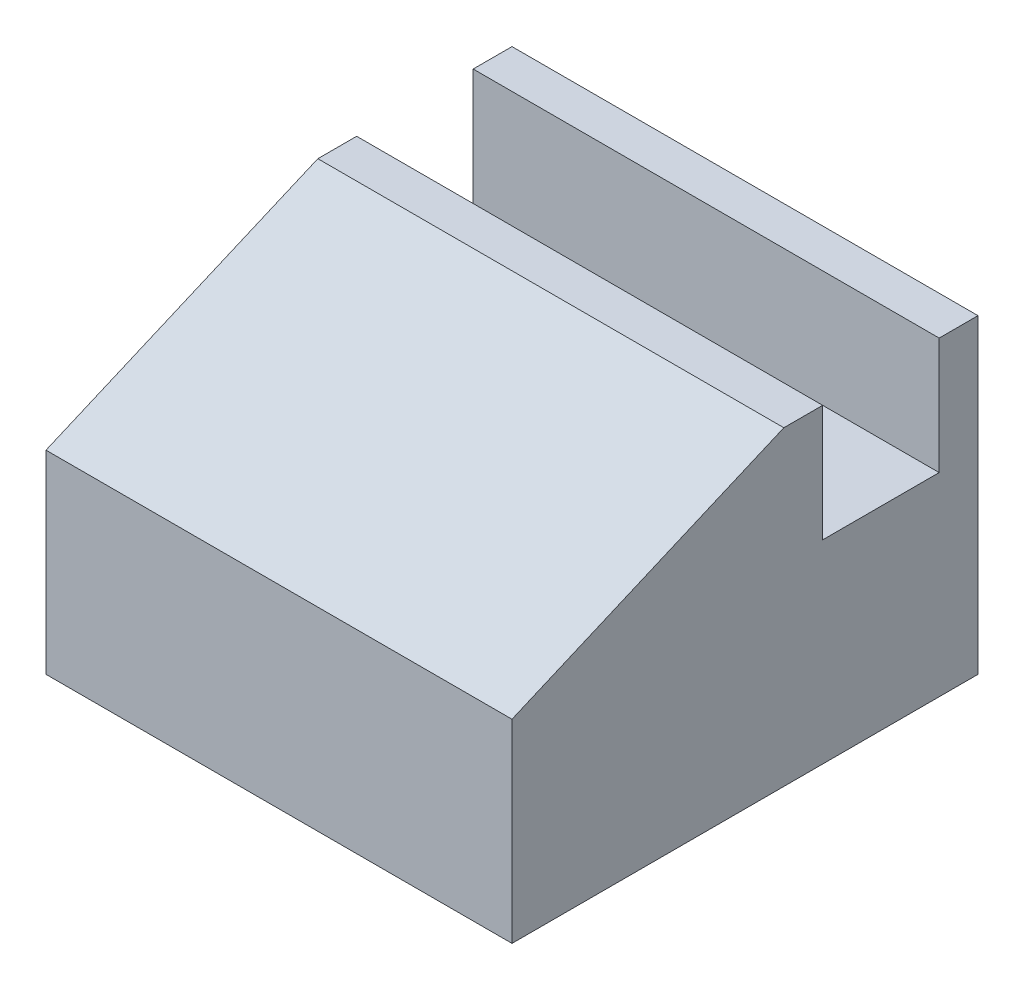
from build123d import *

# Parameters (mm, degrees)
CARD_DEPTH = 76.2


with BuildPart() as part:
    # Main → Card (new body)
    with BuildSketch(Plane(origin=(0, 0, 0), x_dir=(0, 0, -1), z_dir=(1, 0, 0))):
        Polygon((-76.2, -50.8), (-76.2, -19.05), (-31.75, 0), (-25.4, 0), (-25.4, -19.05), (-6.35, -19.05), (-6.35, 0), (0, 0), (0, -50.8), align=None)
    extrude(amount=CARD_DEPTH)


solid = part.part
